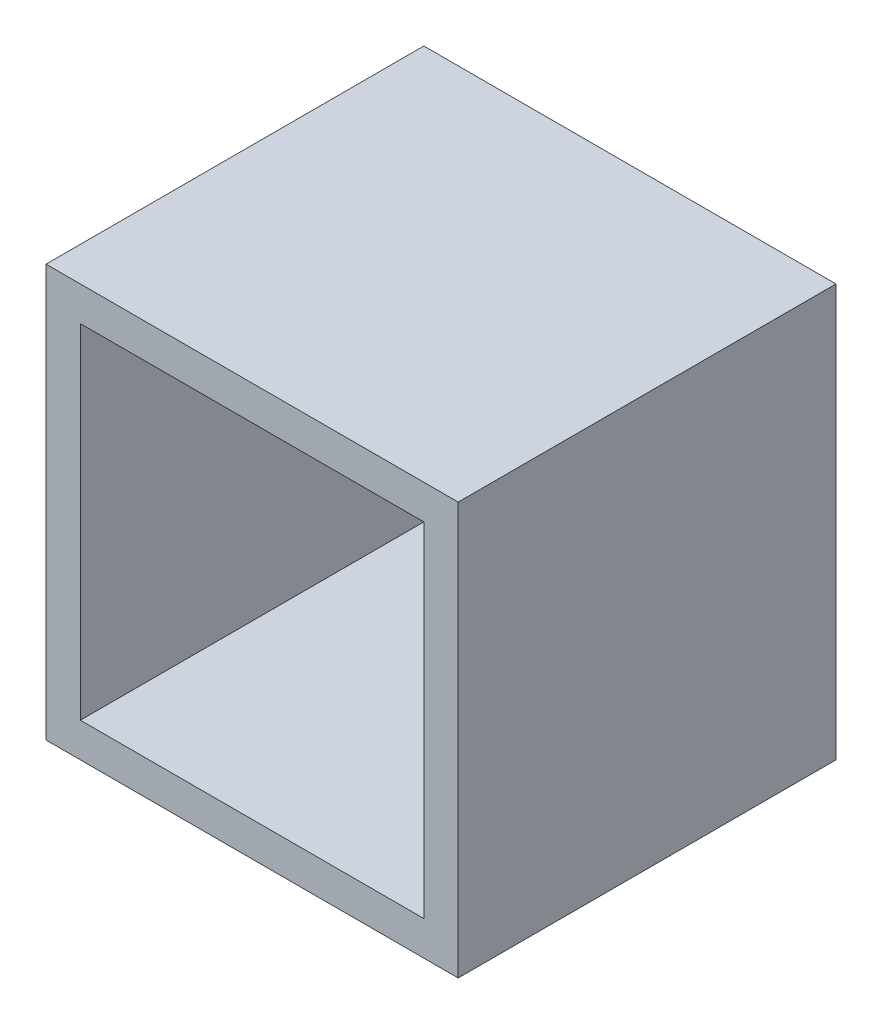
from build123d import *

# Parameters (mm, degrees)
SKETCH1_W           = 5000
SKETCH1_H           = 5000
BOSS_EXTRUDE1_DEPTH = 5000
SHELL3_T            = 500


with BuildPart() as part:
    # Sketch1 → Boss-Extrude1 (new body)
    with BuildSketch(Plane.XY):
        with Locations((2500, -2500)):
            Rectangle(SKETCH1_W, SKETCH1_H)
    extrude(amount=BOSS_EXTRUDE1_DEPTH)

    # Shell3
    shell3_openings = [part.faces().sort_by_distance(p)[0] for p in [
        (2500, -2500, 5000),
    ]]
    offset(amount=SHELL3_T, openings=shell3_openings, kind=Kind.INTERSECTION)


solid = part.part
